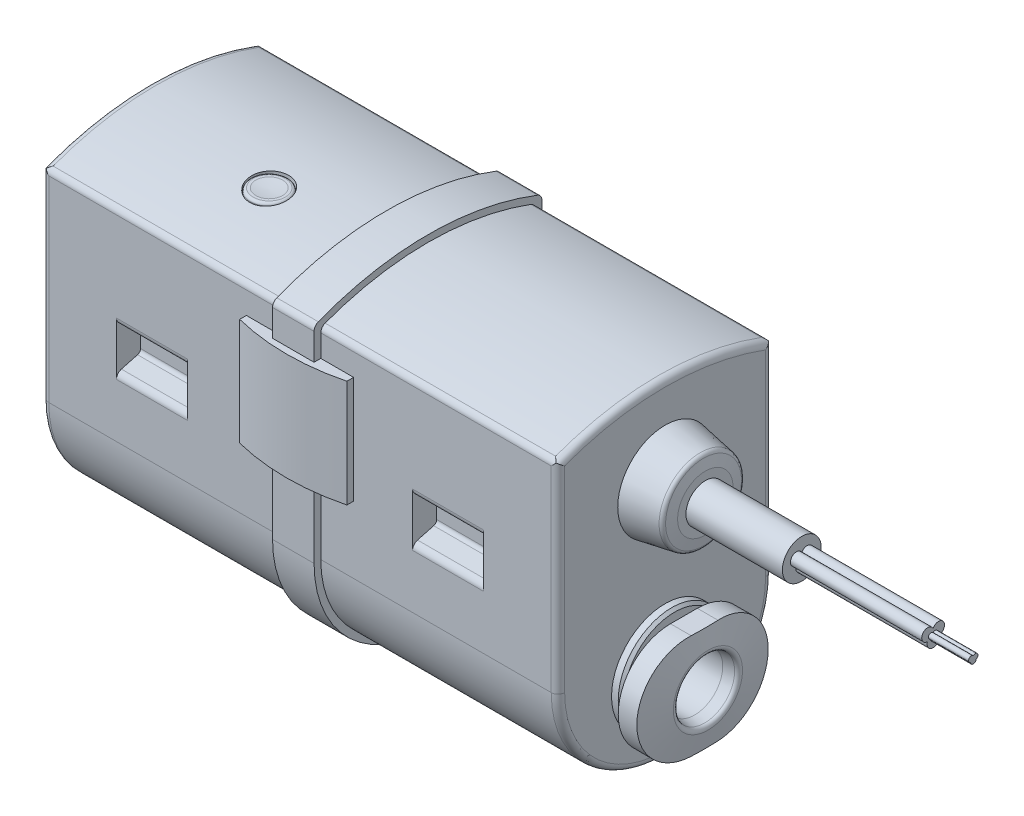
from build123d import *

# Parameters (mm, degrees)
BOSS_EXTRUDE1_DEPTH          = 19.25
BOSS_EXTRUDE1_DEPTH_BACK     = 19.25
CUT_EXTRUDE1_DEPTH           = 25
CUT_EXTRUDE2_DEPTH           = 25
CUT_REVOLVE1_ANGLE           = 90
CUT_REVOLVE1_OTHER_WAY_ANGLE = 90
CUT_REVOLVE2_ANGLE           = 90
CUT_REVOLVE2_OTHER_WAY_ANGLE = 90
CUT_REVOLVE3_ANGLE           = 45
CUT_REVOLVE3_OTHER_WAY_ANGLE = 45
CUT_REVOLVE4_ANGLE           = 45
CUT_REVOLVE4_OTHER_WAY_ANGLE = 45
CUT_EXTRUDE3_DEPTH           = 5.3
CUT_EXTRUDE4_DEPTH           = 5.3
CUT_EXTRUDE5_START           = -5.3
CUT_EXTRUDE5_DEPTH           = 5.3
CUT_EXTRUDE6_START           = -5.3
CUT_EXTRUDE6_DEPTH           = 5.3
BOSS_EXTRUDE2_DEPTH          = 1.55
BOSS_EXTRUDE2_DEPTH_BACK     = 1.55
SKETCH14_W                   = 12
SKETCH14_H                   = 12
CUT_EXTRUDE7_DEPTH           = 2
CUT_EXTRUDE8_START           = 2
SKETCH16_W                   = 12
SKETCH16_H                   = 12
CUT_EXTRUDE8_DEPTH           = 2
BOSS_EXTRUDE3_DEPTH          = 4
BOSS_EXTRUDE3_DEPTH_BACK     = 4
BOSS_EXTRUDE4_DEPTH          = 4
BOSS_EXTRUDE4_DEPTH_BACK     = 4
SKETCH19_W                   = 1.45
SKETCH19_H                   = 5
BOSS_EXTRUDE5_DEPTH          = 9.8
BOSS_EXTRUDE6_DEPTH          = 3


with BuildPart() as part:
    # Sketch1 → Boss-Extrude1 (new, two sides: drawn at the far end of the back side and taken through both)
    with BuildSketch(Plane(origin=(0, 0, 0), x_dir=(0, 0, -1), z_dir=(1, 0, 0)).offset(-BOSS_EXTRUDE1_DEPTH_BACK)):
        with BuildLine():
            Line((8, 8), (8, 22.64944168))
            ThreePointArc((8, 22.64944168), (7.910614967, 22.934740381), (7.674418605, 23.118033347))
            ThreePointArc((7.674418605, 23.118033347), (0, 24.5), (-7.674418605, 23.118033347))
            ThreePointArc((-7.674418605, 23.118033347), (-7.910614967, 22.934740381), (-8, 22.64944168))
            Line((-8, 22.64944168), (-8, 8))
            ThreePointArc((-8, 8), (0, 0), (8, 8))
        make_face()
    extrude(amount=BOSS_EXTRUDE1_DEPTH + BOSS_EXTRUDE1_DEPTH_BACK)

    # Sketch2 → Cut-Extrude1 (cut)
    with BuildSketch(Plane(origin=(0, 0, 0), x_dir=(1, 0, 0), z_dir=(0, 1, 0))):
        with BuildLine():
            Line((0, 18), (0, 8))
            Line((0, 8), (18.75, 8))
            ThreePointArc((18.75, 8), (19.103553391, 7.853553391), (19.25, 7.5))
            Line((19.25, 7.5), (19.25, -7.5))
            ThreePointArc((19.25, -7.5), (19.103553391, -7.853553391), (18.75, -8))
            Line((18.75, -8), (0, -8))
            Line((0, -8), (0, -18))
            Line((0, -18), (29.25, -18))
            Line((29.25, -18), (29.25, 18))
            Line((29.25, 18), (0, 18))
        make_face()
    extrude(amount=CUT_EXTRUDE1_DEPTH, mode=Mode.SUBTRACT)

    # Sketch3 → Cut-Extrude2 (cut)
    with BuildSketch(Plane(origin=(0, 0, 0), x_dir=(1, 0, 0), z_dir=(0, 1, 0))):
        with BuildLine():
            Line((-29.25, 18), (-29.25, -18))
            Line((-29.25, -18), (0, -18))
            Line((0, -18), (0, -8))
            Line((0, -8), (-18.75, -8))
            ThreePointArc((-18.75, -8), (-19.103553391, -7.853553391), (-19.25, -7.5))
            Line((-19.25, -7.5), (-19.25, 7.5))
            ThreePointArc((-19.25, 7.5), (-19.103553391, 7.853553391), (-18.75, 8))
            Line((-18.75, 8), (0, 8))
            Line((0, 8), (0, 18))
            Line((0, 18), (-29.25, 18))
        make_face()
    extrude(amount=CUT_EXTRUDE2_DEPTH, mode=Mode.SUBTRACT)

    # Sketch4 → Cut-Revolve1 (revolve, cut)
    with BuildSketch(Plane.XY):
        with BuildLine():
            Line((-25, 3), (-25, -5.003376947))
            Line((-25, -5.003376947), (-14, -5.003376947))
            Line((-14, -5.003376947), (-14, 0))
            Line((-14, 0), (-18.75, 0))
            ThreePointArc((-18.75, 0), (-19.103553391, 0.146446609), (-19.25, 0.5))
            Line((-19.25, 0.5), (-19.25, 3))
            Line((-19.25, 3), (-25, 3))
        make_face()
    revolve(axis=Axis((-2, 8, 0), (-1, 0, 0)), revolution_arc=CUT_REVOLVE1_ANGLE, mode=Mode.SUBTRACT)

    # Sketch4 → Cut-Revolve1 other way (revolve, cut)
    with BuildSketch(Plane.XY):
        with BuildLine():
            Line((-25, 3), (-25, -5.003376947))
            Line((-25, -5.003376947), (-14, -5.003376947))
            Line((-14, -5.003376947), (-14, 0))
            Line((-14, 0), (-18.75, 0))
            ThreePointArc((-18.75, 0), (-19.103553391, 0.146446609), (-19.25, 0.5))
            Line((-19.25, 0.5), (-19.25, 3))
            Line((-19.25, 3), (-25, 3))
        make_face()
    revolve(axis=Axis((-2, 8, 0), (1, 0, 0)), revolution_arc=CUT_REVOLVE1_OTHER_WAY_ANGLE, mode=Mode.SUBTRACT)

    # Sketch5 → Cut-Revolve2 (revolve, cut)
    with BuildSketch(Plane.XY):
        with BuildLine():
            Line((14, -5.003376947), (25, -5.003376947))
            Line((25, -5.003376947), (25, 3))
            Line((25, 3), (19.25, 3))
            Line((19.25, 3), (19.25, 0.5))
            ThreePointArc((19.25, 0.5), (19.103553391, 0.146446609), (18.75, 0))
            Line((18.75, 0), (14, 0))
            Line((14, 0), (14, -5.003376947))
        make_face()
    revolve(axis=Axis((-2, 8, 0), (-1, 0, 0)), revolution_arc=CUT_REVOLVE2_ANGLE, mode=Mode.SUBTRACT)

    # Sketch5 → Cut-Revolve2 other way (revolve, cut)
    with BuildSketch(Plane.XY):
        with BuildLine():
            Line((14, -5.003376947), (25, -5.003376947))
            Line((25, -5.003376947), (25, 3))
            Line((25, 3), (19.25, 3))
            Line((19.25, 3), (19.25, 0.5))
            ThreePointArc((19.25, 0.5), (19.103553391, 0.146446609), (18.75, 0))
            Line((18.75, 0), (14, 0))
            Line((14, 0), (14, -5.003376947))
        make_face()
    revolve(axis=Axis((-2, 8, 0), (1, 0, 0)), revolution_arc=CUT_REVOLVE2_OTHER_WAY_ANGLE, mode=Mode.SUBTRACT)

    # Sketch6 → Cut-Revolve3 (revolve, cut)
    with BuildSketch(Plane.XY):
        with BuildLine():
            Line((-24.25, 29.5), (-24.25, 22.5))
            Line((-24.25, 22.5), (-19.25, 22.5))
            Line((-19.25, 22.5), (-19.25, 24))
            ThreePointArc((-19.25, 24), (-19.103553391, 24.353553391), (-18.75, 24.5))
            Line((-18.75, 24.5), (-18.75, 29.5))
            Line((-18.75, 29.5), (-24.25, 29.5))
        make_face()
    revolve(axis=Axis((-19.25, 2.5, 0), (1, 0, 0)), revolution_arc=CUT_REVOLVE3_ANGLE, mode=Mode.SUBTRACT)

    # Sketch6 → Cut-Revolve3 other way (revolve, cut)
    with BuildSketch(Plane.XY):
        with BuildLine():
            Line((-24.25, 29.5), (-24.25, 22.5))
            Line((-24.25, 22.5), (-19.25, 22.5))
            Line((-19.25, 22.5), (-19.25, 24))
            ThreePointArc((-19.25, 24), (-19.103553391, 24.353553391), (-18.75, 24.5))
            Line((-18.75, 24.5), (-18.75, 29.5))
            Line((-18.75, 29.5), (-24.25, 29.5))
        make_face()
    revolve(axis=Axis((-19.25, 2.5, 0), (-1, 0, 0)), revolution_arc=CUT_REVOLVE3_OTHER_WAY_ANGLE, mode=Mode.SUBTRACT)

    # Sketch7 → Cut-Revolve4 (revolve, cut)
    with BuildSketch(Plane.XY):
        with BuildLine():
            Line((19.25, 24), (19.25, 22.5))
            Line((19.25, 22.5), (24.25, 22.5))
            Line((24.25, 22.5), (24.25, 29.5))
            Line((24.25, 29.5), (18.75, 29.5))
            Line((18.75, 29.5), (18.75, 24.5))
            ThreePointArc((18.75, 24.5), (19.103553391, 24.353553391), (19.25, 24))
        make_face()
    revolve(axis=Axis((24.25, 2.5, 0), (1, 0, 0)), revolution_arc=CUT_REVOLVE4_ANGLE, mode=Mode.SUBTRACT)

    # Sketch7 → Cut-Revolve4 other way (revolve, cut)
    with BuildSketch(Plane.XY):
        with BuildLine():
            Line((19.25, 24), (19.25, 22.5))
            Line((19.25, 22.5), (24.25, 22.5))
            Line((24.25, 22.5), (24.25, 29.5))
            Line((24.25, 29.5), (18.75, 29.5))
            Line((18.75, 29.5), (18.75, 24.5))
            ThreePointArc((18.75, 24.5), (19.103553391, 24.353553391), (19.25, 24))
        make_face()
    revolve(axis=Axis((24.25, 2.5, 0), (-1, 0, 0)), revolution_arc=CUT_REVOLVE4_OTHER_WAY_ANGLE, mode=Mode.SUBTRACT)

    # Sketch8 → Cut-Extrude3 (cut)
    with BuildSketch(Plane(origin=(-13.7, 0, 0), x_dir=(0, 0, -1), z_dir=(1, 0, 0))):
        with BuildLine():
            Line((-10, 17), (-10, 10))
            Line((-10, 10), (-8, 10))
            Line((-8, 10), (-8, 12.016336506))
            ThreePointArc((-8, 12.016336506), (-7.89667667, 12.320717221), (-7.629409523, 12.499299419))
            Line((-7.629409523, 12.499299419), (-6.422354286, 12.822728895))
            ThreePointArc((-6.422354286, 12.822728895), (-6.261993998, 12.929878214), (-6.2, 13.112506643))
            Line((-6.2, 13.112506643), (-6.2, 14.887493357))
            ThreePointArc((-6.2, 14.887493357), (-6.261993998, 15.070121786), (-6.422354286, 15.177271105))
            Line((-6.422354286, 15.177271105), (-7.629409523, 15.500700581))
            ThreePointArc((-7.629409523, 15.500700581), (-7.89667667, 15.679282779), (-8, 15.983663494))
            Line((-8, 15.983663494), (-8, 17))
            Line((-8, 17), (-10, 17))
        make_face()
    extrude(amount=CUT_EXTRUDE3_DEPTH, mode=Mode.SUBTRACT)

    # Sketch9 → Cut-Extrude4 (cut)
    with BuildSketch(Plane(origin=(-13.7, 0, 0), x_dir=(0, 0, -1), z_dir=(1, 0, 0))):
        with BuildLine():
            Line((6.2, 14.887493357), (6.2, 13.112506643))
            ThreePointArc((6.2, 13.112506643), (6.261993998, 12.929878214), (6.422354286, 12.822728895))
            Line((6.422354286, 12.822728895), (7.629409523, 12.499299419))
            ThreePointArc((7.629409523, 12.499299419), (7.89667667, 12.320717221), (8, 12.016336506))
            Line((8, 12.016336506), (8, 10))
            Line((8, 10), (10, 10))
            Line((10, 10), (10, 17))
            Line((10, 17), (8, 17))
            Line((8, 17), (8, 15.983663494))
            ThreePointArc((8, 15.983663494), (7.89667667, 15.679282779), (7.629409523, 15.500700581))
            Line((7.629409523, 15.500700581), (6.422354286, 15.177271105))
            ThreePointArc((6.422354286, 15.177271105), (6.261993998, 15.070121786), (6.2, 14.887493357))
        make_face()
    extrude(amount=CUT_EXTRUDE4_DEPTH, mode=Mode.SUBTRACT)

    # Sketch10 → Cut-Extrude5 (cut)
    with BuildSketch(Plane(origin=(13.7, 0, 0), x_dir=(0, 0, -1), z_dir=(1, 0, 0)).offset(CUT_EXTRUDE5_START)):
        with BuildLine():
            Line((-10, 17), (-10, 10))
            Line((-10, 10), (-8, 10))
            Line((-8, 10), (-8, 12.016336506))
            ThreePointArc((-8, 12.016336506), (-7.89667667, 12.320717221), (-7.629409523, 12.499299419))
            Line((-7.629409523, 12.499299419), (-6.422354286, 12.822728895))
            ThreePointArc((-6.422354286, 12.822728895), (-6.261993998, 12.929878214), (-6.2, 13.112506643))
            Line((-6.2, 13.112506643), (-6.2, 14.887493357))
            ThreePointArc((-6.2, 14.887493357), (-6.261993998, 15.070121786), (-6.422354286, 15.177271105))
            Line((-6.422354286, 15.177271105), (-7.629409523, 15.500700581))
            ThreePointArc((-7.629409523, 15.500700581), (-7.89667667, 15.679282779), (-8, 15.983663494))
            Line((-8, 15.983663494), (-8, 17))
            Line((-8, 17), (-10, 17))
        make_face()
    extrude(amount=CUT_EXTRUDE5_DEPTH, mode=Mode.SUBTRACT)

    # Sketch11 → Cut-Extrude6 (cut)
    with BuildSketch(Plane(origin=(13.7, 0, 0), x_dir=(0, 0, -1), z_dir=(1, 0, 0)).offset(CUT_EXTRUDE6_START)):
        with BuildLine():
            Line((6.2, 14.887493357), (6.2, 13.112506643))
            ThreePointArc((6.2, 13.112506643), (6.261993998, 12.929878214), (6.422354286, 12.822728895))
            Line((6.422354286, 12.822728895), (7.629409523, 12.499299419))
            ThreePointArc((7.629409523, 12.499299419), (7.89667667, 12.320717221), (8, 12.016336506))
            Line((8, 12.016336506), (8, 10))
            Line((8, 10), (10, 10))
            Line((10, 10), (10, 17))
            Line((10, 17), (8, 17))
            Line((8, 17), (8, 15.983663494))
            ThreePointArc((8, 15.983663494), (7.89667667, 15.679282779), (7.629409523, 15.500700581))
            Line((7.629409523, 15.500700581), (6.422354286, 15.177271105))
            ThreePointArc((6.422354286, 15.177271105), (6.261993998, 15.070121786), (6.2, 14.887493357))
        make_face()
    extrude(amount=CUT_EXTRUDE6_DEPTH, mode=Mode.SUBTRACT)

    # Sketch12 → Boss-Extrude2 (add, two sides: drawn at the far end of the back side and taken through both)
    with BuildSketch(Plane(origin=(0, 0, 0), x_dir=(0, 0, -1), z_dir=(1, 0, 0)).offset(-BOSS_EXTRUDE2_DEPTH_BACK)):
        with BuildLine():
            Line((8.5, 8), (8.5, 22.993901532))
            ThreePointArc((8.5, 22.993901532), (8.412861412, 23.275939569), (8.181818182, 23.459672021))
            ThreePointArc((8.181818182, 23.459672021), (0, 25), (-8.181818182, 23.459672021))
            ThreePointArc((-8.181818182, 23.459672021), (-8.412861412, 23.275939569), (-8.5, 22.993901532))
            Line((-8.5, 22.993901532), (-8.5, 8))
            ThreePointArc((-8.5, 8), (0, -0.5), (8.5, 8))
        make_face()
    extrude(amount=BOSS_EXTRUDE2_DEPTH + BOSS_EXTRUDE2_DEPTH_BACK)

    # Sketch13 → Revolve1 (revolve)
    with BuildSketch(Plane.XY):
        with BuildLine():
            Line((19.25, 8.1), (21.45, 8.1))
            Line((21.45, 8.1), (22.202833893, 8.234689012))
            ThreePointArc((22.202833893, 8.234689012), (22.39584333, 8.358066708), (22.445513271, 8.581690489))
            Line((22.445513271, 8.581690489), (22.04, 10.9))
            Line((22.04, 10.9), (20.65, 10.9))
            Line((20.65, 10.9), (20.65, 8.6))
            Line((20.65, 8.6), (19.95, 8.6))
            Line((19.95, 8.6), (19.95, 9.8))
            Line((19.95, 9.8), (19.75, 10))
            Line((19.75, 10), (19.25, 10))
            Line((19.25, 10), (19.25, 8.1))
        make_face()
    revolve(axis=Axis((22.45, 6, 0), (-1, 0, 0)))

    # Sketch14 → Cut-Extrude7 (cut)
    with BuildSketch(Plane(origin=(22.45, 0, 0), x_dir=(0, 0, -1), z_dir=(1, 0, 0))):
        with Locations((0, 6)):
            Rectangle(SKETCH14_W, SKETCH14_H)
        with BuildLine():
            Line((-1, 2.1), (1, 2.1))
            ThreePointArc((1, 2.1), (4.9, 6), (1, 9.9))
            Line((1, 9.9), (-1, 9.9))
            ThreePointArc((-1, 9.9), (-4.9, 6), (-1, 2.1))
        make_face(mode=Mode.SUBTRACT)
    extrude(amount=-CUT_EXTRUDE7_DEPTH, mode=Mode.SUBTRACT)

    # Sketch15 → Revolve2 (revolve)
    with BuildSketch(Plane.XY):
        with BuildLine():
            Line((-22.202833893, 8.234689012), (-21.45, 8.1))
            Line((-21.45, 8.1), (-19.25, 8.1))
            Line((-19.25, 8.1), (-19.25, 10))
            Line((-19.25, 10), (-19.75, 10))
            Line((-19.75, 10), (-19.95, 9.8))
            Line((-19.95, 9.8), (-19.95, 8.6))
            Line((-19.95, 8.6), (-20.65, 8.6))
            Line((-20.65, 8.6), (-20.65, 10.9))
            Line((-20.65, 10.9), (-22.04, 10.9))
            Line((-22.04, 10.9), (-22.445513271, 8.581690489))
            ThreePointArc((-22.445513271, 8.581690489), (-22.39584333, 8.358066708), (-22.202833893, 8.234689012))
        make_face()
    revolve(axis=Axis((-19.25, 6, 0), (-1, 0, 0)))

    # Sketch16 → Cut-Extrude8 (cut)
    with BuildSketch(Plane(origin=(-22.45, 0, 0), x_dir=(0, 0, -1), z_dir=(1, 0, 0)).offset(CUT_EXTRUDE8_START)):
        with Locations((0, 6)):
            Rectangle(SKETCH16_W, SKETCH16_H)
        with BuildLine():
            Line((-1, 2.1), (1, 2.1))
            ThreePointArc((1, 2.1), (4.9, 6), (1, 9.9))
            Line((1, 9.9), (-1, 9.9))
            ThreePointArc((-1, 9.9), (-4.9, 6), (-1, 2.1))
        make_face(mode=Mode.SUBTRACT)
    extrude(amount=-CUT_EXTRUDE8_DEPTH, mode=Mode.SUBTRACT)

    # Sketch17 → Boss-Extrude3 (add, two sides: drawn at the far end of the back side and taken through both)
    with BuildSketch(Plane(origin=(0, 17, 0), x_dir=(1, 0, 0), z_dir=(0, 1, 0)).offset(-BOSS_EXTRUDE3_DEPTH_BACK)):
        with BuildLine():
            Line((-4, -8), (-4, -8.5))
            ThreePointArc((-4, -8.5), (0, -9), (4, -8.5))
            Line((4, -8.5), (4, -8))
            Line((4, -8), (-4, -8))
        make_face()
    extrude(amount=BOSS_EXTRUDE3_DEPTH + BOSS_EXTRUDE3_DEPTH_BACK)

    # Sketch18 → Boss-Extrude4 (add, two sides: drawn at the far end of the back side and taken through both)
    with BuildSketch(Plane(origin=(0, 17, 0), x_dir=(1, 0, 0), z_dir=(0, 1, 0)).offset(-BOSS_EXTRUDE4_DEPTH_BACK)):
        with BuildLine():
            Line((-4, 8), (4, 8))
            Line((4, 8), (4, 8.5))
            ThreePointArc((4, 8.5), (0, 9), (-4, 8.5))
            Line((-4, 8.5), (-4, 8))
        make_face()
    extrude(amount=BOSS_EXTRUDE4_DEPTH + BOSS_EXTRUDE4_DEPTH_BACK)

    # Sketch19 → Cut-Revolve5 (revolve, cut)
    with BuildSketch(Plane.XY.offset(2.3)):
        with Locations((-7.275, 24.5)):
            Rectangle(SKETCH19_W, SKETCH19_H)
    revolve(axis=Axis((-8, 22, 2.3), (0, 1, 0)), mode=Mode.SUBTRACT)

    # Sketch20 → Revolve3 (revolve)
    with BuildSketch(Plane.XY.offset(2.3)):
        with BuildLine():
            Line((-7, 24.4), (-6.8, 24.4))
            ThreePointArc((-6.8, 24.4), (-6.658578644, 24.341421356), (-6.6, 24.2))
            Line((-6.6, 24.2), (-6.6, 22))
            Line((-6.6, 22), (-8, 22))
            Line((-8, 22), (-8, 24.3))
            ThreePointArc((-8, 24.3), (-7.498428155, 24.33428155), (-7, 24.4))
        make_face()
    revolve(axis=Axis((-8, 22, 2.3), (0, 1, 0)))

    # Sketch21 → Revolve4 (revolve)
    with BuildSketch(Plane.XY):
        with BuildLine():
            Line((19.25, 18), (19.25, 21.537788324))
            Line((19.25, 21.537788324), (21.872094453, 21.075442326))
            ThreePointArc((21.872094453, 21.075442326), (22.032132034, 20.992132034), (22.115442326, 20.832094453))
            Line((22.115442326, 20.832094453), (22.25, 20.068979963))
            Line((22.25, 20.068979963), (22.25, 19.45))
            Line((22.25, 19.45), (29.45, 19.45))
            Line((29.45, 19.45), (29.45, 18))
            Line((29.45, 18), (19.25, 18))
        make_face()
    revolve(axis=Axis((29.45, 18, 0), (-1, 0, 0)))

    # Sketch22 → Boss-Extrude5 (add)
    with BuildSketch(Plane(origin=(39.25, 0, 0), x_dir=(0, 0, -1), z_dir=(1, 0, 0))):
        with BuildLine():
            ThreePointArc((0, 18.406155281), (-0.777837851, 18.444414727), (-0.424036398, 17.750642401))
            ThreePointArc((-0.424036398, 17.750642401), (0, 17.15), (0.424036398, 17.750642401))
            ThreePointArc((0.424036398, 17.750642401), (0.777837851, 18.444414727), (0, 18.406155281))
        make_face()
    extrude(amount=-BOSS_EXTRUDE5_DEPTH)

    # Sketch23 → Boss-Extrude6 (add)
    with BuildSketch(Plane(origin=(39.25, 0, 0), x_dir=(0, 0, -1), z_dir=(1, 0, 0))):
        with BuildLine():
            ThreePointArc((0, 18.132287566), (-0.320493103, 18.104556692), (-0.19989996, 17.80632503))
            ThreePointArc((-0.19989996, 17.80632503), (0, 17.6), (0.19989996, 17.80632503))
            ThreePointArc((0.19989996, 17.80632503), (0.320493103, 18.104556692), (0, 18.132287566))
        make_face()
    extrude(amount=BOSS_EXTRUDE6_DEPTH)


solid = part.part
